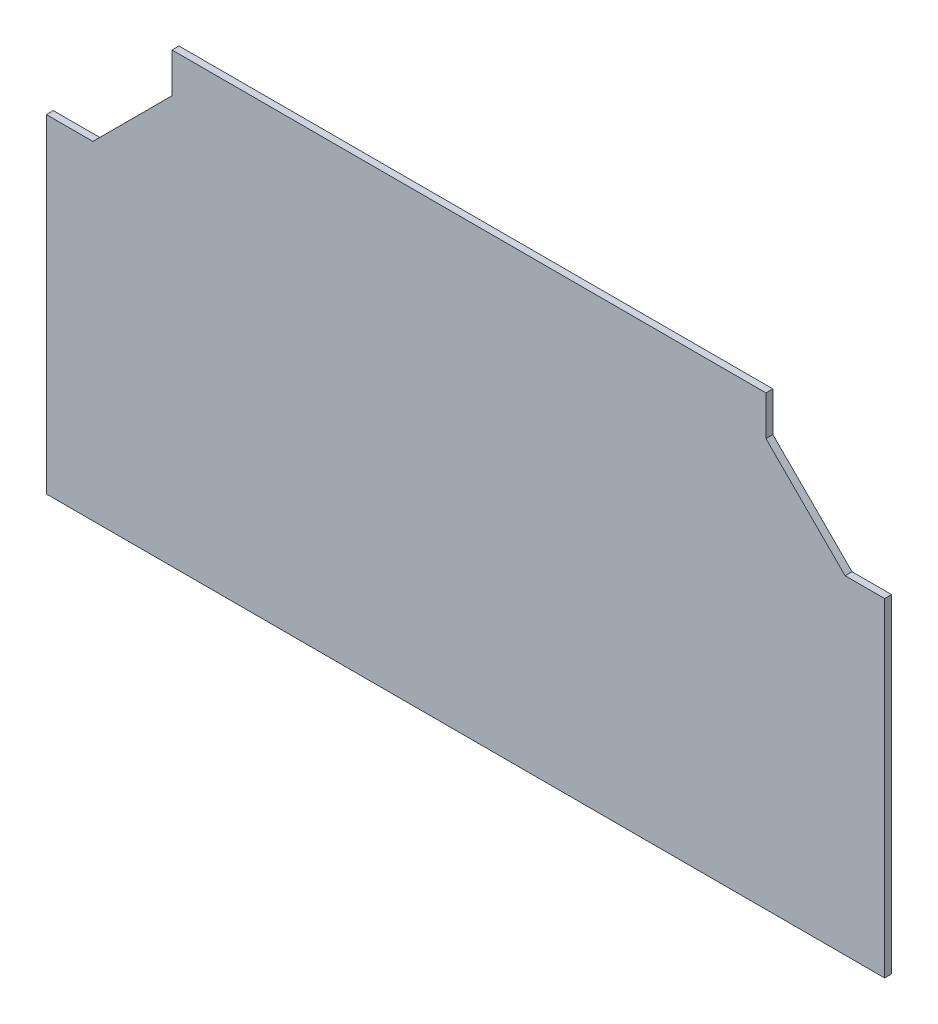
from build123d import *

# Parameters (mm, degrees)
BOSS_EXTRUDE2_DEPTH = 3.5


with BuildPart() as part:
    # Sketch1 → Boss-Extrude2 (new body)
    with BuildSketch(Plane.XY):
        Polygon((-420, 0), (-423.5, 0), (-423.5, 166), (-400, 166), (-360, 206), (-360, 226), (-60, 226), (-60, 206), (-20, 166), (0, 166), (0, 6), (0, 0), (-60, 0), (-360, 0), align=None)
    extrude(amount=BOSS_EXTRUDE2_DEPTH)


solid = part.part
